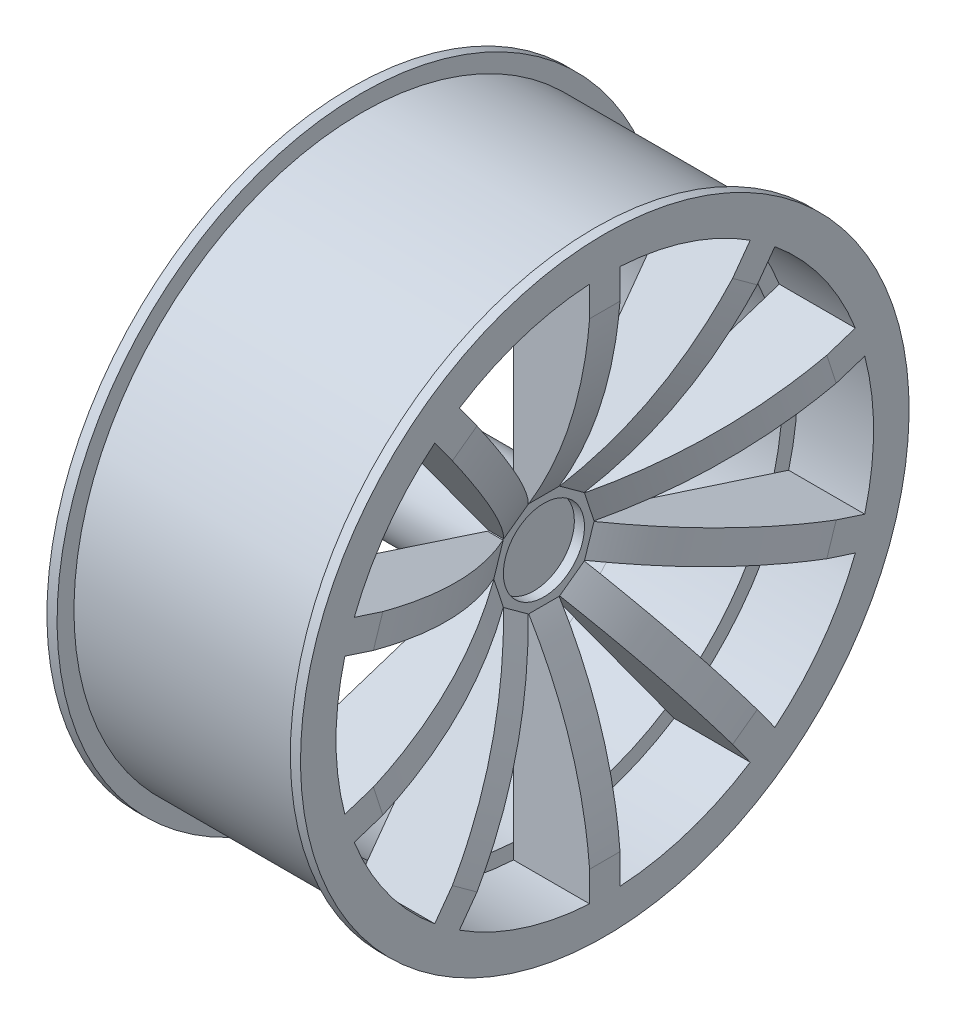
from build123d import *

# Parameters (mm, degrees)
CROQUIS1_W              = 24
CROQUIS1_H              = 5
SALIENTE_EXTRUIR1_DEPTH = 1.5
MATRIZC1_COUNT          = 10
CROQUIS3_R              = 4
CORTAR_EXTRUIR1_DEPTH   = 1
CROQUIS4_R              = 2.5
CORTAR_EXTRUIR2_DEPTH   = 5
SCALE1_SCALE            = 0.957142857


with BuildPart() as part:
    # Croquis1 → Revolución1 (revolve)
    with BuildSketch(Plane.XY):
        Polygon((-12, 26.5), (-12, 30), (-11, 30), (-11, 28.33342991), (12, 28.33342991), (12, 30), (13, 30), (13, 26.5), (5.499345391, 26.5), (5.499345391, 25), (-5.499345391, 25), align=None)
        with Locations((-5, 2.5)):
            Rectangle(CROQUIS1_W, CROQUIS1_H)
    revolve(axis=Axis((-17, 0, 0), (-1, 0, 0)))

    # Croquis2 → Saliente-Extruir1 (add, symmetric)
    with BuildSketch(Plane.XY):
        with BuildLine():
            Line((13, 26.5), (13, 23.5))
            add(Edge.make_bspline(
                [(13, 23.5), (12.190614948, 13.316000856), (7, 4.7)],
                knots=[0, 0, 0, 1, 1, 1], degree=2))
            Line((7, 4.7), (5.499345391, 4.7))
            Line((5.499345391, 4.7), (5.499345391, 26.5))
            Line((5.499345391, 26.5), (13, 26.5))
        make_face()
    saliente_extruir1 = extrude(amount=SALIENTE_EXTRUIR1_DEPTH, both=True)

    # MatrizC1: Saliente-Extruir1 ×10 about axis
    matrizc1_axis = Axis((5.499345391, 0, 0), (1, 0, 0))
    for i in range(1, MATRIZC1_COUNT):
        add(saliente_extruir1.rotate(matrizc1_axis, i * 360 / MATRIZC1_COUNT))

    # Croquis3 → Cortar-Extruir1 (cut)
    with BuildSketch(Plane(origin=(7, 0, 0), x_dir=(0, 0, -1), z_dir=(1, 0, 0))):
        with Locations(Location((0, 0, 0), (0, 0, 90))):
            Circle(CROQUIS3_R)
    extrude(amount=-CORTAR_EXTRUIR1_DEPTH, mode=Mode.SUBTRACT)

    # Croquis4 → Cortar-Extruir2 (cut)
    with BuildSketch(Plane.ZY.offset(17)):
        with Locations(Location((0, 0, 0), (0, 0, 270))):
            Circle(CROQUIS4_R)
    extrude(amount=-CORTAR_EXTRUIR2_DEPTH, mode=Mode.SUBTRACT)


with BuildPart() as part_1:
    # Scale1: scaled about (1.224671263, 0, 0)
    add(part.part.scale(SCALE1_SCALE).moved(Location((0.052485911, 0, 0))))


solid = part_1.part
